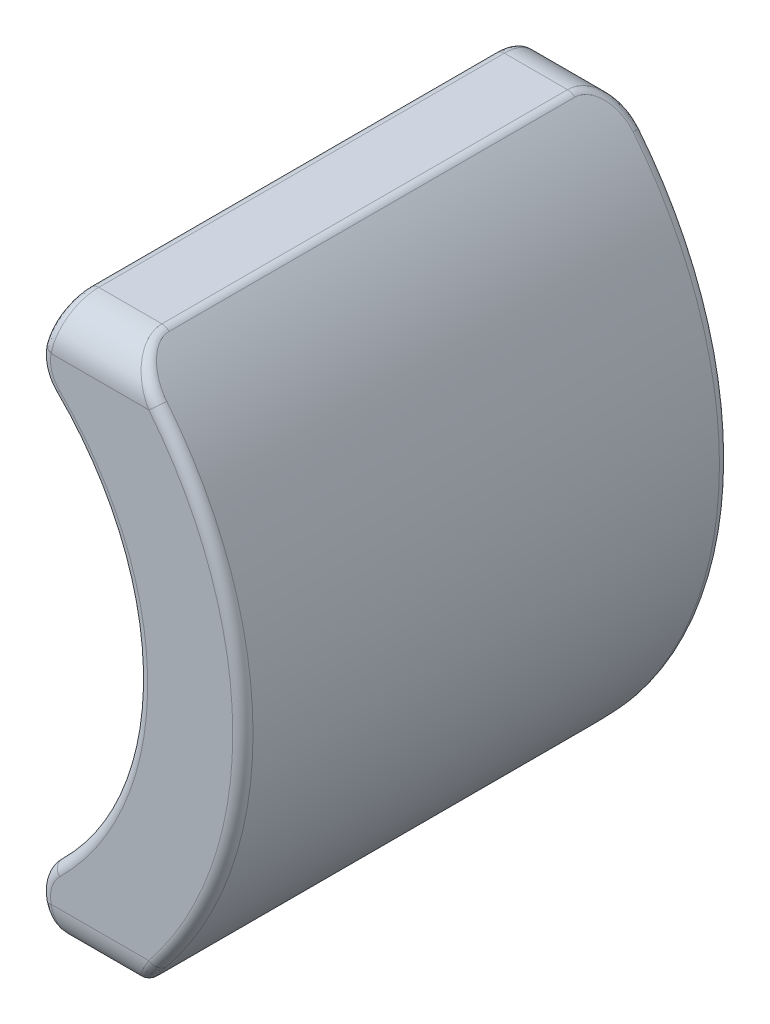
from build123d import *

# Parameters (mm, degrees)
EXTRUDE_1_DEPTH = 12
FILLET_1_R      = 1
FILLET_2_R      = 1
FILLET_3_R      = 0.25


with BuildPart() as part:
    # 草图1 → 凸台-拉伸1 (new body)
    with BuildSketch(Plane.XY):
        with BuildLine():
            Line((4.878137725, -6.88), (4.531835438, -5.38))
            ThreePointArc((4.531835438, -5.38), (7.034339517, 0), (4.531835438, 5.38))
            Line((4.531835438, 5.38), (4.878137725, 6.88))
            Line((4.878137725, 6.88), (6.738137725, 6.88))
            ThreePointArc((6.738137725, 6.88), (9.63, 0), (6.738137725, -6.88))
            Line((6.738137725, -6.88), (4.878137725, -6.88))
        make_face()
    extrude(amount=EXTRUDE_1_DEPTH)

    # 圆角1
    fillet_1_edges = [part.edges().sort_by_distance(p)[0] for p in [
        (4.531835438, -5.38, 6),
        (4.531835438, 5.38, 6),
    ]]
    fillet(fillet_1_edges, radius=FILLET_1_R)

    # 圆角2
    fillet_2_edges = [part.edges().sort_by_distance(p)[0] for p in [
        (5.808137725, -6.88, 12),
        (5.808137725, -6.88, 0),
        (5.808137725, 6.88, 0),
        (5.808137725, 6.88, 12),
    ]]
    fillet(fillet_2_edges, radius=FILLET_2_R)

    # 圆角3
    fillet_3_edges = [part.edges().sort_by_distance(p)[0] for p in [
        (7.034339517, 0, 0),
        (4.687877266, 5.411310183, 0),
        (7.034339517, 0, 12),
        (4.687877266, -5.411310183, 12),
        (9.63, 0, 12),
        (4.687877266, 5.411310183, 12),
        (9.63, 0, 0),
        (6.738137725, 6.88, 6),
        (6.738137725, -6.88, 6),
        (7.064336577, 6.544619807, 11.7471817),
        (7.064336577, 6.544619807, 0.2528183),
        (7.064336577, -6.544619807, 0.2528183),
        (7.064336589, -6.544619821, 11.747181705),
        (4.878137725, -6.88, 6),
        (4.815123489, -6.607055355, 0.313421155),
        (4.815123489, -6.607055355, 11.686578845),
        (4.687877266, -5.411310183, 0),
        (4.655934772, -5.914769545, 0.000604643),
        (4.655934772, -5.914769545, 11.999395357),
        (4.878137725, 6.88, 6),
        (4.815123489, 6.607055355, 11.686578845),
        (4.815123489, 6.607055355, 0.313421155),
        (4.655934776, 5.914769544, 11.99939535),
        (4.655934776, 5.914769544, 0.00060465),
    ]]
    fillet(fillet_3_edges, radius=FILLET_3_R)


solid = part.part
